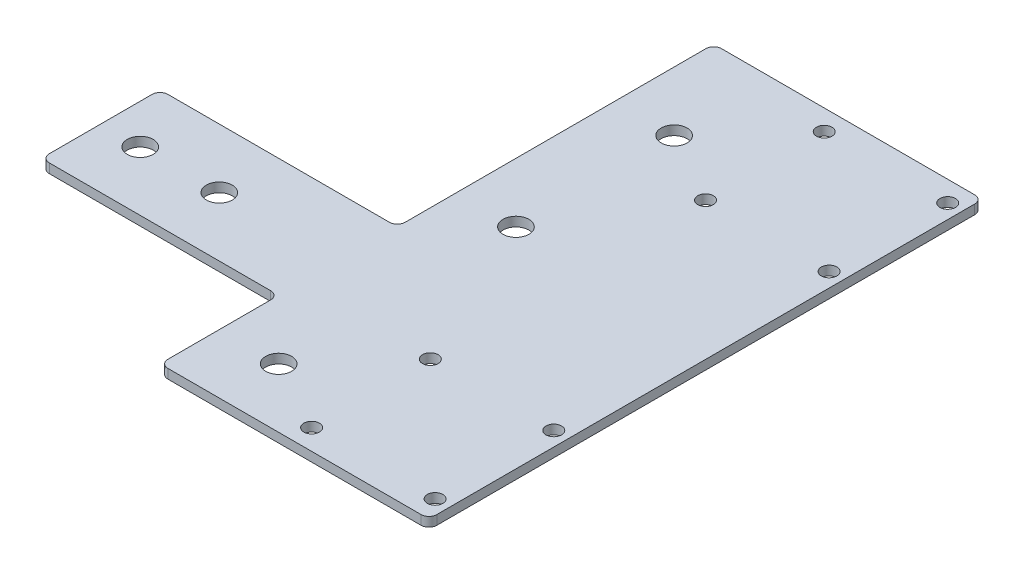
from build123d import *

# Parameters (mm, degrees)
SKETCH1_R           = 2.5
SKETCH1_R_2         = 4.1656
BOSS_EXTRUDE1_DEPTH = 3


with BuildPart() as part:
    # Sketch1 → Boss-Extrude1 (new body)
    with BuildSketch(Plane(origin=(0, 0, 0), x_dir=(1, 0, 0), z_dir=(0, 1, 0))):
        with BuildLine():
            Line((-108.6375, -53.522608696), (-108.6375, -86.542608696))
            ThreePointArc((-108.6375, -86.542608696), (-107.893551224, -88.33865992), (-106.0975, -89.082608696))
            Line((-106.0975, -89.082608696), (-24.8175, -89.082608696))
            ThreePointArc((-24.8175, -89.082608696), (-23.021448776, -88.33865992), (-22.2775, -86.542608696))
            Line((-22.2775, -86.542608696), (-22.2775, 86.177391304))
            ThreePointArc((-22.2775, 86.177391304), (-23.021448776, 87.973442529), (-24.8175, 88.717391304))
            Line((-24.8175, 88.717391304), (-106.0975, 88.717391304))
            ThreePointArc((-106.0975, 88.717391304), (-107.893551224, 87.973442529), (-108.6375, 86.177391304))
            Line((-108.6375, 86.177391304), (-108.6375, -10.342608696))
            ThreePointArc((-108.6375, -10.342608696), (-109.381448776, -12.13865992), (-111.1775, -12.882608696))
            Line((-111.1775, -12.882608696), (-182.2975, -12.882608696))
            ThreePointArc((-182.2975, -12.882608696), (-184.093551224, -13.626557471), (-184.8375, -15.422608696))
            Line((-184.8375, -15.422608696), (-184.8375, -48.442608696))
            ThreePointArc((-184.8375, -48.442608696), (-184.093551224, -50.23865992), (-182.2975, -50.982608696))
            Line((-182.2975, -50.982608696), (-111.1775, -50.982608696))
            ThreePointArc((-111.1775, -50.982608696), (-109.381448776, -51.726557471), (-108.6375, -53.522608696))
        make_face()
        with Locations(Location((-66.5475, 82.117391304, 0), (0, 0, 270))):
            Circle(SKETCH1_R, mode=Mode.SUBTRACT)
        with Locations(Location((-26.8975, 82.117391304, 0), (0, 0, 270))):
            Circle(SKETCH1_R, mode=Mode.SUBTRACT)
        with Locations(Location((-66.5475, 44.017391304, 0), (0, 0, 270))):
            Circle(SKETCH1_R, mode=Mode.SUBTRACT)
        with Locations(Location((-26.8975, 44.017391304, 0), (0, 0, 270))):
            Circle(SKETCH1_R, mode=Mode.SUBTRACT)
        with Locations(Location((-26.8975, -44.382608696, 0), (0, 0, 90))):
            Circle(SKETCH1_R, mode=Mode.SUBTRACT)
        with Locations(Location((-66.5475, -44.382608696, 0), (0, 0, 90))):
            Circle(SKETCH1_R, mode=Mode.SUBTRACT)
        with Locations(Location((-26.8975, -82.482608696, 0), (0, 0, 90))):
            Circle(SKETCH1_R, mode=Mode.SUBTRACT)
        with Locations(Location((-66.5475, -82.482608696, 0), (0, 0, 90))):
            Circle(SKETCH1_R, mode=Mode.SUBTRACT)
        with Locations(Location((-89.5875, -70.032608696, 0), (0, 0, 270))):
            Circle(SKETCH1_R_2, mode=Mode.SUBTRACT)
        with Locations(Location((-89.5875, 6.167391304, 0), (0, 0, 270))):
            Circle(SKETCH1_R_2, mode=Mode.SUBTRACT)
        with Locations(Location((-89.5875, 56.967391304, 0), (0, 0, 270))):
            Circle(SKETCH1_R_2, mode=Mode.SUBTRACT)
        with Locations(Location((-172.1375, -31.932608696, 0), (0, 0, 270))):
            Circle(SKETCH1_R_2, mode=Mode.SUBTRACT)
        with Locations(Location((-146.7375, -31.932608696, 0), (0, 0, 270))):
            Circle(SKETCH1_R_2, mode=Mode.SUBTRACT)
    extrude(amount=BOSS_EXTRUDE1_DEPTH)


solid = part.part
